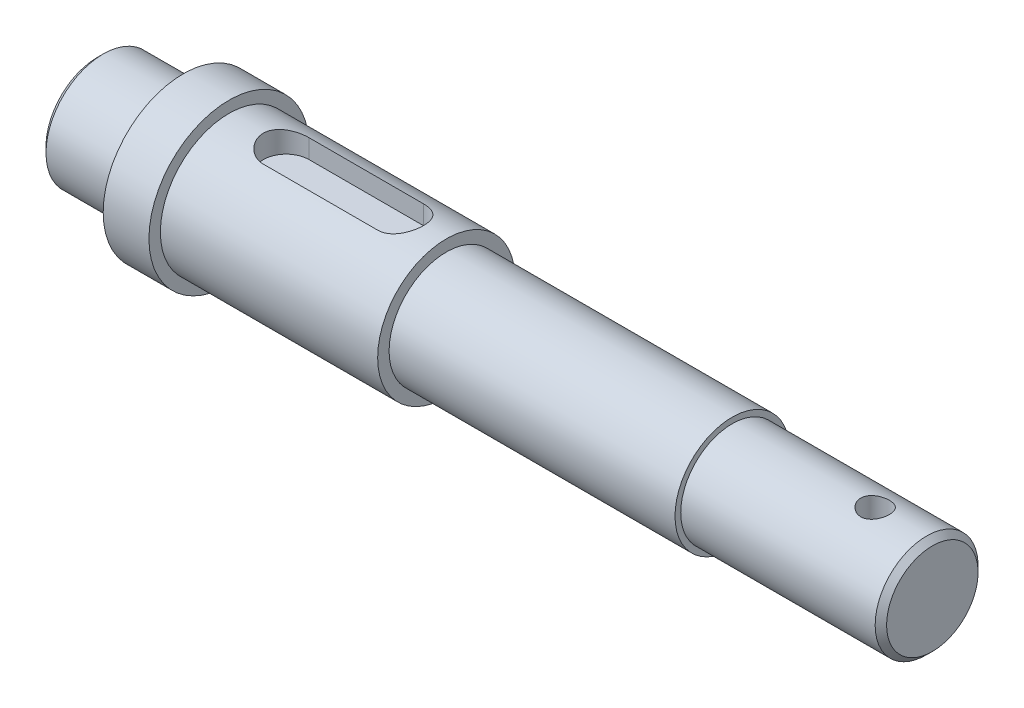
from build123d import *

# Parameters (mm, degrees)
CHAMFER1_SIZE      = 1
SKETCH2_R          = 2.5
CUT_EXTRUDE1_DEPTH = 97.115975922
CUT_EXTRUDE2_DEPTH = 4


with BuildPart() as part:
    # Sketch1 → Revolve1 (revolve)
    with BuildSketch(Plane.XY, mode=Mode.PRIVATE) as revolve1_sk:
        Polygon((-92.26744186, 0), (-92.26744186, 10), (-77.26744186, 10), (-77.26744186, 14), (-69.26744186, 14), (-69.26744186, 12), (-31.26744186, 12), (-31.26744186, 10), (18.73255814, 10), (18.73255814, 9), (53.73255814, 9), (53.73255814, 0), align=None)
    revolve(revolve1_sk.sketch.rotate(Axis((-99.418604651, 0, 0), (1, 0, 0)), 90), axis=Axis((-99.418604651, 0, 0), (1, 0, 0)))

    # Chamfer1
    chamfer1_edges = [part.edges().sort_by_distance(p)[0] for p in [
        (-92.26744186, 0, -10),
        (53.73255814, 0, -9),
    ]]
    chamfer(chamfer1_edges, length=CHAMFER1_SIZE)

    # Sketch2 → Cut-Extrude1 (cut, through all)
    with BuildSketch(Plane(origin=(0, 9, 0), x_dir=(1, 0, 0), z_dir=(0, 1, 0))):
        with Locations(Location((43.73255814, 0, 0), (0, 0, 270))):
            Circle(SKETCH2_R)
    extrude(amount=-CUT_EXTRUDE1_DEPTH, mode=Mode.SUBTRACT)

    # Sketch3 → Cut-Extrude2 (cut)
    with BuildSketch(Plane(origin=(0, 12, 0), x_dir=(1, 0, 0), z_dir=(0, 1, 0))):
        with BuildLine():
            Line((-59.26744186, 4), (-39.26744186, 4))
            ThreePointArc((-39.26744186, 4), (-35.26744186, 0), (-39.26744186, -4))
            Line((-39.26744186, -4), (-59.26744186, -4))
            ThreePointArc((-59.26744186, -4), (-63.26744186, 0), (-59.26744186, 4))
        make_face()
    extrude(amount=-CUT_EXTRUDE2_DEPTH, mode=Mode.SUBTRACT)


solid = part.part
